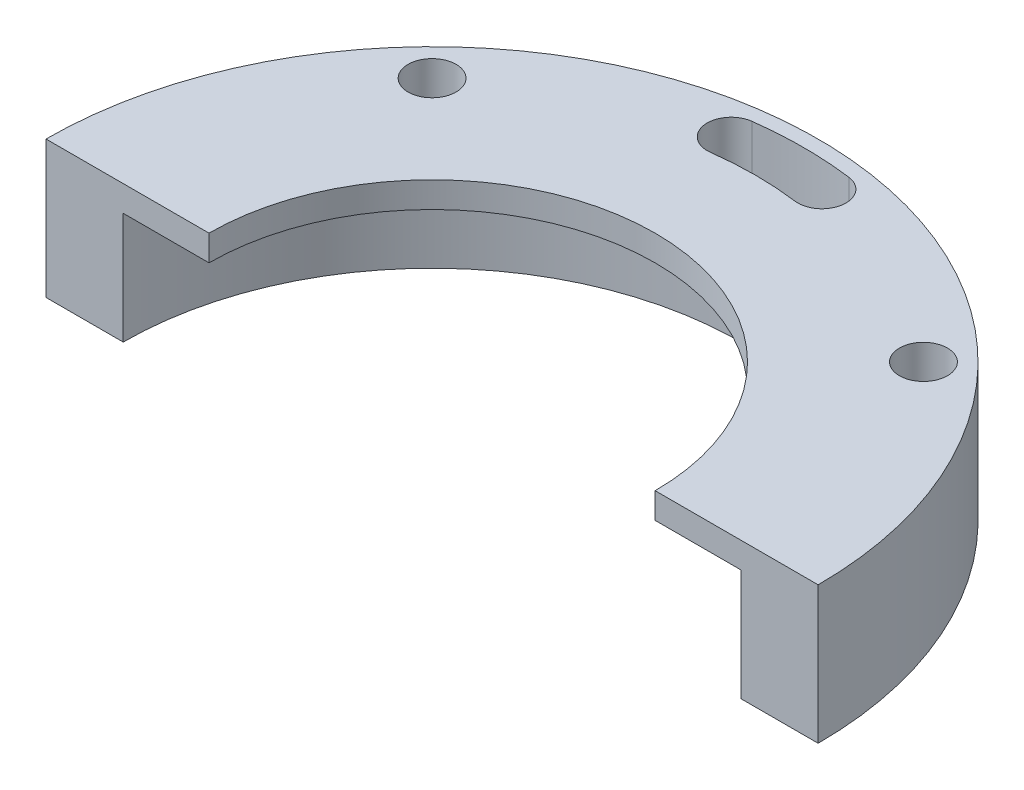
from build123d import *

# Parameters (mm, degrees)
SKETCH1_R           = 28.575
BOSS_EXTRUDE1_DEPTH = 10.16
SKETCH2_R           = 16.51
CUT_EXTRUDE1_DEPTH  = 42.66877548
SKETCH3_R           = 22.86
CUT_EXTRUDE2_DEPTH  = 8.255
SKETCH4_W           = 88.915115744
SKETCH4_H           = 51.352535237
CUT_EXTRUDE3_DEPTH  = 42.66877548
CUT_EXTRUDE4_REACH  = 43.669
SKETCH6_R           = 1.778
CUT_EXTRUDE5_DEPTH  = 42.66877548


with BuildPart() as part:
    # Sketch1 → Boss-Extrude1 (new body)
    with BuildSketch(Plane(origin=(0, 0, 0), x_dir=(1, 0, 0), z_dir=(0, 1, 0))):
        with Locations(Location((0, 0, 0), (0, 0, 270))):
            Circle(SKETCH1_R)
    extrude(amount=BOSS_EXTRUDE1_DEPTH)

    # Sketch2 → Cut-Extrude1 (cut, through all)
    with BuildSketch(Plane.XZ):
        with Locations(Location((0, 0, 0), (0, 0, 270))):
            Circle(SKETCH2_R)
    extrude(amount=-CUT_EXTRUDE1_DEPTH, mode=Mode.SUBTRACT)

    # Sketch3 → Cut-Extrude2 (cut)
    with BuildSketch(Plane.XZ):
        with Locations(Location((0, 0, 0), (0, 0, 270))):
            Circle(SKETCH3_R)
    extrude(amount=-CUT_EXTRUDE2_DEPTH, mode=Mode.SUBTRACT)

    # Sketch4 → Cut-Extrude3 (cut, through all)
    with BuildSketch(Plane(origin=(0, 10.16, 0), x_dir=(1, 0, 0), z_dir=(0, 1, 0))):
        with Locations((4.883047594, -25.676267619)):
            Rectangle(SKETCH4_W, SKETCH4_H)
    extrude(amount=-CUT_EXTRUDE3_DEPTH, mode=Mode.SUBTRACT)

    # Sketch6 → Cut-Extrude4 (cut, up to next)
    with BuildSketch(Plane.XZ, mode=Mode.PRIVATE) as cut_extrude4_sk1:
        with Locations(Location((18.185018645, -18.185018645, 0), (0, 0, 270))):
            Circle(SKETCH6_R)
    cut_extrude4_tool1 = extrude(cut_extrude4_sk1.sketch, amount=-CUT_EXTRUDE4_REACH, mode=Mode.PRIVATE) & part.part
    # Sketch6 → Cut-Extrude4 (cut, up to next)
    with BuildSketch(Plane.XZ, mode=Mode.PRIVATE) as cut_extrude4_sk2:
        with Locations(Location((-18.185018645, -18.185018645, 0), (0, 0, 270))):
            Circle(SKETCH6_R)
    cut_extrude4_tool2 = extrude(cut_extrude4_sk2.sketch, amount=-CUT_EXTRUDE4_REACH, mode=Mode.PRIVATE) & part.part
    add(cut_extrude4_tool1.solids().sort_by_distance((18.185019, 0, -18.185019))[0], mode=Mode.SUBTRACT)
    add(cut_extrude4_tool2.solids().sort_by_distance((-18.185019, 0, -18.185019))[0], mode=Mode.SUBTRACT)

    # Sketch7 → Cut-Extrude5 (cut, through all)
    with BuildSketch(Plane(origin=(0, 10.16, 0), x_dir=(1, 0, 0), z_dir=(0, 1, 0))):
        with BuildLine():
            ThreePointArc((3.124731779, 23.734694259), (0, 23.9395), (-3.124731779, 23.734694259))
            ThreePointArc((-3.124731779, 23.734694259), (-5.119596312, 25.265407653), (-3.588882918, 27.260272186))
            ThreePointArc((-3.588882918, 27.260272186), (0, 27.4955), (3.588882918, 27.260272186))
            ThreePointArc((3.588882918, 27.260272186), (5.119596312, 25.265407653), (3.124731779, 23.734694259))
        make_face()
    extrude(amount=-CUT_EXTRUDE5_DEPTH, mode=Mode.SUBTRACT)


solid = part.part
